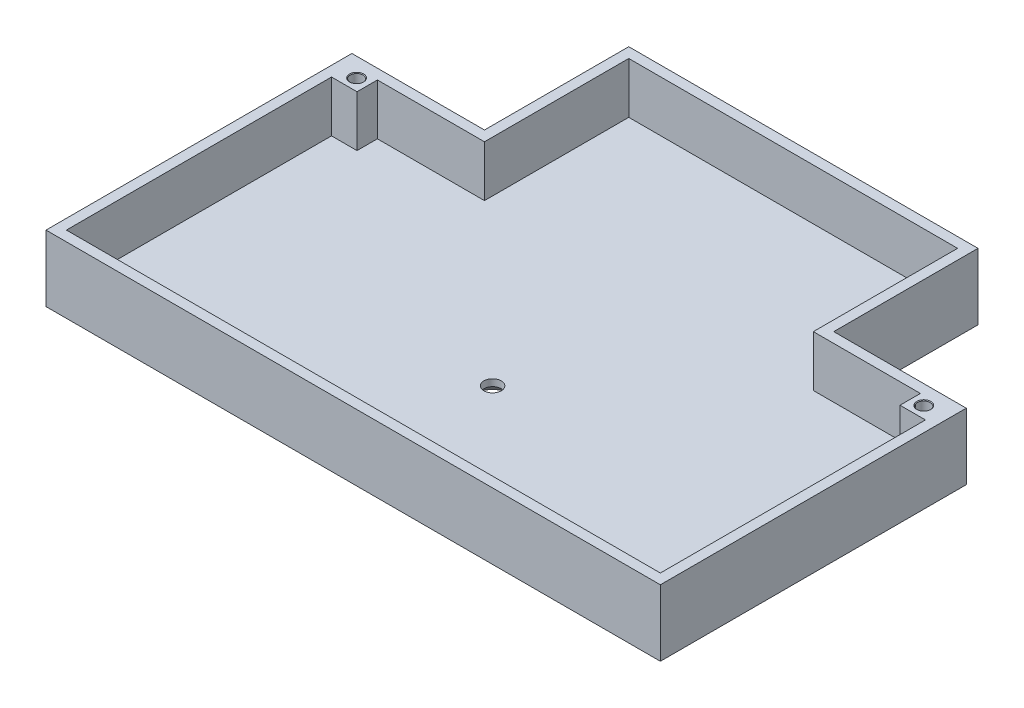
from build123d import *

# Parameters (mm, degrees)
SKETCH1_W                                            = 120.5
SKETCH1_H                                            = 60
BOSS_EXTRUDE1_DEPTH                                  = 3
SKETCH3_W                                            = 68.5
SKETCH3_H                                            = 28.3
BOSS_EXTRUDE3_DEPTH                                  = 3
BOSS_EXTRUDE2_DEPTH                                  = 10
CSK_FOR_M3_HEX_SOCKET_COUNTERSUNK_CAP_SC_D           = 3.4
CSK_FOR_M3_HEX_SOCKET_COUNTERSUNK_CAP_SC_CSINK_D     = 6.72
CSK_FOR_M3_HEX_SOCKET_COUNTERSUNK_CAP_SC_CSINK_ANGLE = 90
SKETCH6_W                                            = 5
SKETCH6_H                                            = 4
BOSS_EXTRUDE4_DEPTH                                  = 10


with BuildPart() as part:
    # Sketch1 → Boss-Extrude1 (new body)
    with BuildSketch(Plane(origin=(0, 0, 0), x_dir=(1, 0, 0), z_dir=(0, 1, 0))):
        Rectangle(SKETCH1_W, SKETCH1_H)
    extrude(amount=BOSS_EXTRUDE1_DEPTH)

    # Sketch3 → Boss-Extrude3 (add)
    with BuildSketch(Plane.XZ):
        with Locations((0, -44.15)):
            Rectangle(SKETCH3_W, SKETCH3_H)
    extrude(amount=-BOSS_EXTRUDE3_DEPTH)

    # Sketch2 → Boss-Extrude2 (add)
    with BuildSketch(Plane(origin=(0, 3, 0), x_dir=(1, 0, 0), z_dir=(0, 1, 0))):
        Polygon((60.25, 30), (34.25, 30), (34.25, 58.3), (-34.25, 58.3), (-34.25, 30), (-60.25, 30), (-60.25, -30), (60.25, -30), align=None)
        Polygon((-32.25, 28), (-58.25, 28), (-58.25, -28), (58.25, -28), (58.25, 28), (32.25, 28), (32.25, 56.3), (-32.25, 56.3), align=None, mode=Mode.SUBTRACT)
    extrude(amount=BOSS_EXTRUDE2_DEPTH)

    # CSK for M3 Hex Socket Countersunk Cap Screw1 (through all)
    with Locations(Plane(origin=(0, 0, 0), x_dir=(-1, 0, 0), z_dir=(0, -1, 0))):
        with Locations((0, -2.66)):
            CounterSinkHole(CSK_FOR_M3_HEX_SOCKET_COUNTERSUNK_CAP_SC_D / 2, CSK_FOR_M3_HEX_SOCKET_COUNTERSUNK_CAP_SC_CSINK_D / 2, counter_sink_angle=CSK_FOR_M3_HEX_SOCKET_COUNTERSUNK_CAP_SC_CSINK_ANGLE)

    # Sketch6 → Boss-Extrude4 (add)
    with BuildSketch(Plane(origin=(0, 3, 0), x_dir=(1, 0, 0), z_dir=(0, 1, 0))):
        with Locations((-55.75, 26)):
            Rectangle(SKETCH6_W, SKETCH6_H)
    boss_extrude4 = extrude(amount=BOSS_EXTRUDE4_DEPTH)

    # Sketch8 → Ø2.5 (2.5) Diameter Hole1 (revolve, cut)
    with BuildSketch(Plane(origin=(-55.626, 13, -26.296), x_dir=(0, 0, 1), z_dir=(1, 0, 0))):
        Polygon((0, 0), (0, 8.751075774), (1.25, 8), (1.25, 0.125), (1.375, 0), align=None)
    f_2_5_2_5_diameter_hole1 = revolve(axis=Axis((-55.626, 19.35, -26.296), (0, -1, 0)), mode=Mode.SUBTRACT)

    # Mirror1: Boss-Extrude4, Ø2.5 (2.5) Diameter Hole1 across plane
    add(boss_extrude4.mirror(Plane(origin=(0, 0, 0), x_dir=(0, 0, 1), z_dir=(1, 0, 0))))
    add(f_2_5_2_5_diameter_hole1.mirror(Plane(origin=(0, 0, 0), x_dir=(0, 0, 1), z_dir=(1, 0, 0))), mode=Mode.SUBTRACT)


solid = part.part
